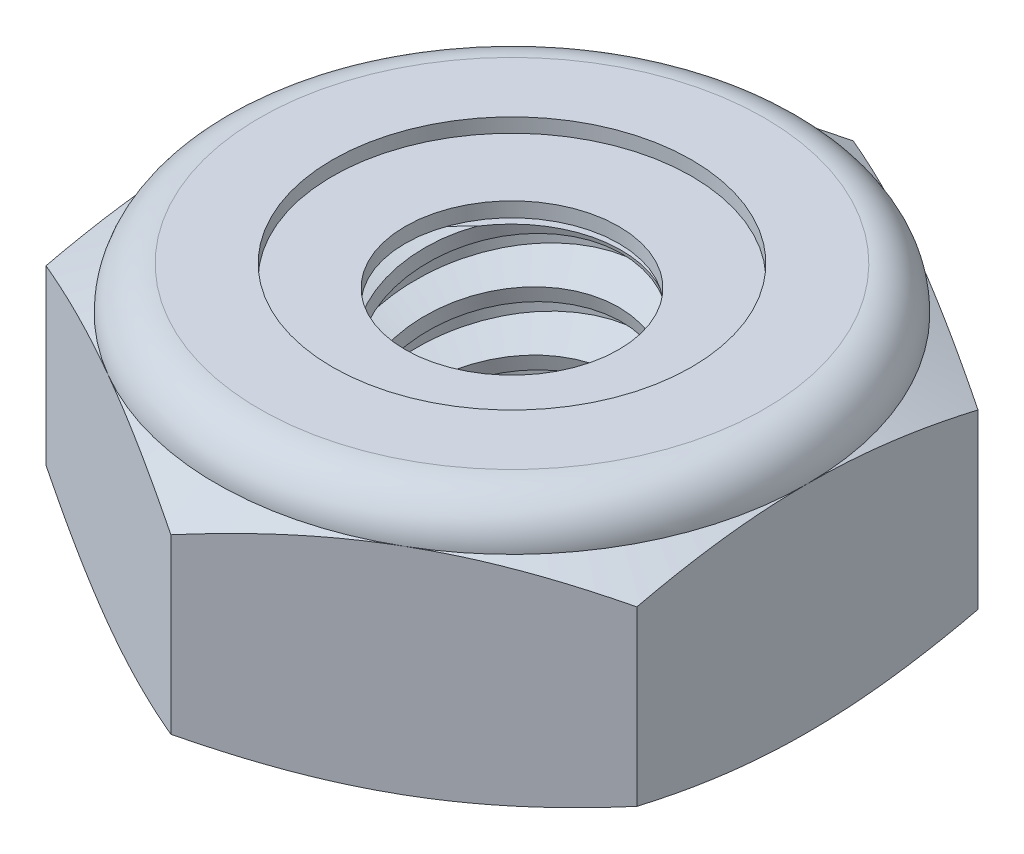
from build123d import *

# Parameters (mm, degrees)
EXTRUDE1_DEPTH      = 2.778125
SKETCH2_W           = 1.4224
SKETCH2_H           = 2.778125
LPATTERN1_COUNT     = 4
LPATTERN1_PITCH     = 0.635
LPATTERN1_COL_COUNT = 2
LPATTERN1_COL_PITCH = 0.635


with BuildPart() as part:
    # Sketch1 → Extrude1 (new body)
    with BuildSketch(Plane(origin=(0, 0, 0), x_dir=(1, 0, 0), z_dir=(0, 1, 0))):
        Polygon((0, 3.666174209), (-3.175, 1.833087105), (-3.175, -1.833087105), (0, -3.666174209), (3.175, -1.833087105), (3.175, 1.833087105), align=None)
    extrude(amount=EXTRUDE1_DEPTH)

    # Sketch4 → Cut-Revolve2 (revolve, cut)
    with BuildSketch(Plane(origin=(0, 0, 0), x_dir=(0, 0, -1), z_dir=(1, 0, 0))):
        Polygon((0, 2.778125), (1.4224, 2.778125), (1.147473684, 2.649924754), (1.147473684, 0.128200246), (1.4224, 0), (0, 0), align=None)
    revolve(axis=Axis((0, 2.778125, 0), (0, 1, 0)), mode=Mode.SUBTRACT)


with BuildPart() as body_2:
    # Sketch2 → Revolve1 (revolve)
    with BuildSketch(Plane(origin=(0, 0, 0), x_dir=(0, 0, -1), z_dir=(1, 0, 0))):
        with Locations((0.7112, 1.3890625)):
            Rectangle(SKETCH2_W, SKETCH2_H)
    revolve(axis=Axis((0, -1.4224, 0), (0, 1, 0)))

    # Sketch3 → Cut-Revolve1 (revolve, cut)
    with BuildSketch(Plane(origin=(0, 0, 0), x_dir=(0, 0, -1), z_dir=(1, 0, 0)), mode=Mode.PRIVATE) as cut_revolve1_sk:
        Polygon((1.439692084, 2.700656462), (1.560736676, 2.158376693), (1.182057853, 2.277171117), (1.147473684, 2.432108194), align=None)
    cut_revolve1 = revolve(cut_revolve1_sk.sketch.rotate(Axis((0, 2.778125, 0.152561988), (0, -0.9759815859905214, -0.21785303258717015)), 180), axis=Axis((0, 2.778125, 0.152561988), (0, -0.9759815859905214, -0.21785303258717015)), mode=Mode.SUBTRACT)

    # LPattern1: Cut-Revolve1 ×4
    with Locations(*[(0, -i * LPATTERN1_PITCH, 0) for i in range(1, LPATTERN1_COUNT)]):
        add(cut_revolve1, mode=Mode.SUBTRACT)

    # LPattern1 col: Cut-Revolve1 ×2
    with Locations(*[(0, i * LPATTERN1_COL_PITCH, 0) for i in range(1, LPATTERN1_COL_COUNT)]):
        add(cut_revolve1, mode=Mode.SUBTRACT)


with BuildPart() as part_1:
    add(part.part)

    # Combine1: cut body 2
    add(body_2.part, mode=Mode.SUBTRACT)

    # Sketch5 → Cut-Revolve3 (revolve, cut)
    with BuildSketch(Plane(origin=(0, 0, 0), x_dir=(0, 0, -1), z_dir=(1, 0, 0)), mode=Mode.PRIVATE) as cut_revolve3_sk:
        with BuildLine():
            Line((0, 0), (3.175, 0))
            Line((3.175, 0), (3.666174209, 0.229038295))
            Line((3.666174209, 0.229038295), (3.666174209, 2.086065871))
            Line((3.666174209, 2.086065871), (3.175, 2.315104167))
            ThreePointArc((3.175, 2.315104167), (3.039384338, 2.642509338), (2.711979167, 2.778125))
            Line((2.711979167, 2.778125), (2.711979167, 4.048125))
            Line((2.711979167, 4.048125), (4.936174209, 4.048125))
            Line((4.936174209, 4.048125), (4.936174209, -1.27))
            Line((4.936174209, -1.27), (0, -1.27))
            Line((0, -1.27), (0, 0))
        make_face()
    revolve(cut_revolve3_sk.sketch.rotate(Axis((0, 0, 0), (0, 1, 0)), 47.880307698), axis=Axis((0, 0, 0), (0, 1, 0)), mode=Mode.SUBTRACT)

    # Sketch6 → Cut-Revolve4 (revolve, cut)
    with BuildSketch(Plane(origin=(0, 0, 0), x_dir=(0, 0, -1), z_dir=(1, 0, 0)), mode=Mode.PRIVATE) as cut_revolve4_sk:
        with BuildLine():
            Line((0, 2.315104167), (3.0226, 2.315104167))
            ThreePointArc((3.0226, 2.315104167), (2.931621264, 2.534746264), (2.711979167, 2.625725))
            Line((2.711979167, 2.625725), (1.929726426, 2.625725))
            Line((1.929726426, 2.625725), (1.929726426, 4.048125))
            Line((1.929726426, 4.048125), (0, 4.048125))
            Line((0, 4.048125), (0, 2.315104167))
        make_face()
    revolve(cut_revolve4_sk.sketch.rotate(Axis((0, 4.048125, 0), (0, 1, 0)), 47.880307698), axis=Axis((0, 4.048125, 0), (0, 1, 0)), mode=Mode.SUBTRACT)


with BuildPart() as body_2_2:
    # Sketch7 → Revolve2 (revolve)
    with BuildSketch(Plane(origin=(0, 0, 0), x_dir=(0, 0, -1), z_dir=(1, 0, 0))):
        with BuildLine():
            Line((1.147473684, 2.391304167), (2.933669688, 2.391304167))
            ThreePointArc((2.933669688, 2.391304167), (2.848159671, 2.505912964), (2.711979167, 2.549525))
            Line((2.711979167, 2.549525), (1.147473684, 2.549525))
            Line((1.147473684, 2.549525), (1.147473684, 2.391304167))
        make_face()
    revolve(axis=Axis((0, 2.391304167, 0), (0, 1, 0)))


solid = Compound([part_1.part, body_2_2.part])
